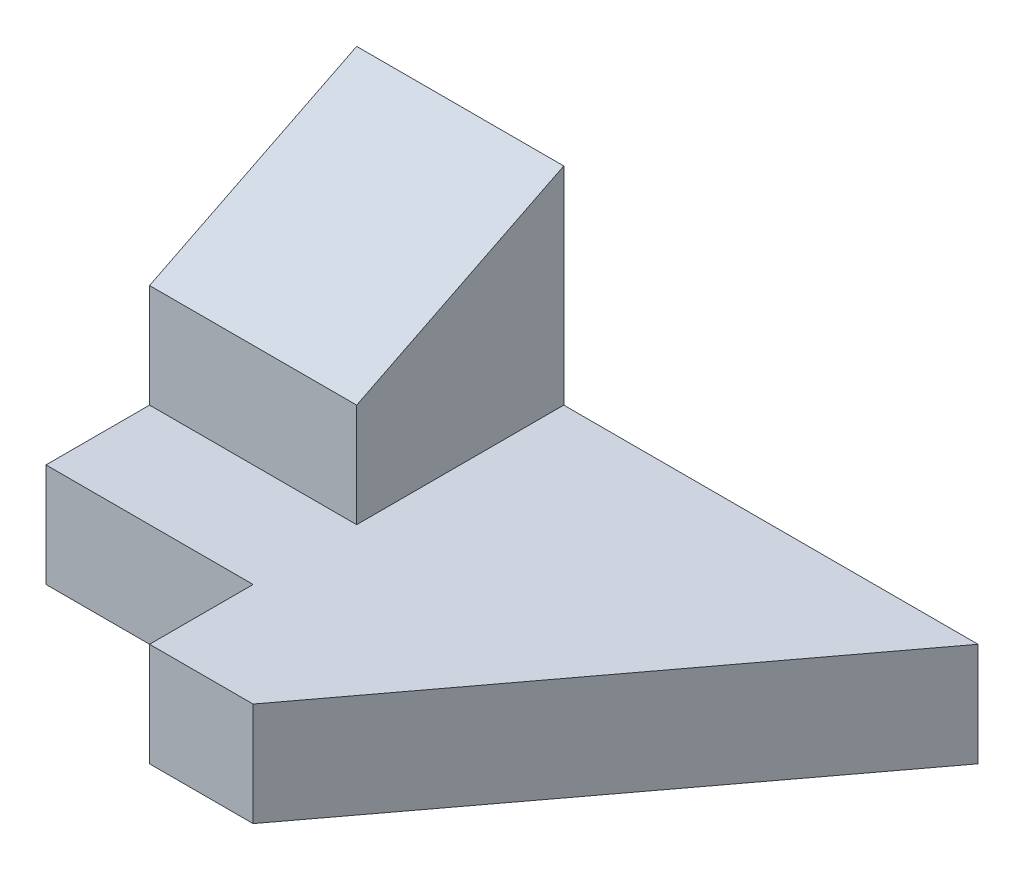
from build123d import *

# Parameters (mm, degrees)
EXTRUDE_1_DEPTH = 5
EXTRUDE_2_DEPTH = 10


with BuildPart() as part:
    # 草圖1 → 填料-伸長1 (new body)
    with BuildSketch(Plane(origin=(0, 0, 0), x_dir=(1, 0, 0), z_dir=(0, 1, 0))):
        Polygon((0, 0), (30, 0), (15, -20), (10, -20), (10, -15), (0, -15), align=None)
    extrude(amount=EXTRUDE_1_DEPTH)

    # 草圖2 → 填料-伸長2 (add)
    with BuildSketch(Plane.ZY):
        Polygon((0, 5), (0, 15), (10, 10), (10, 5), align=None)
    extrude(amount=-EXTRUDE_2_DEPTH)


solid = part.part
